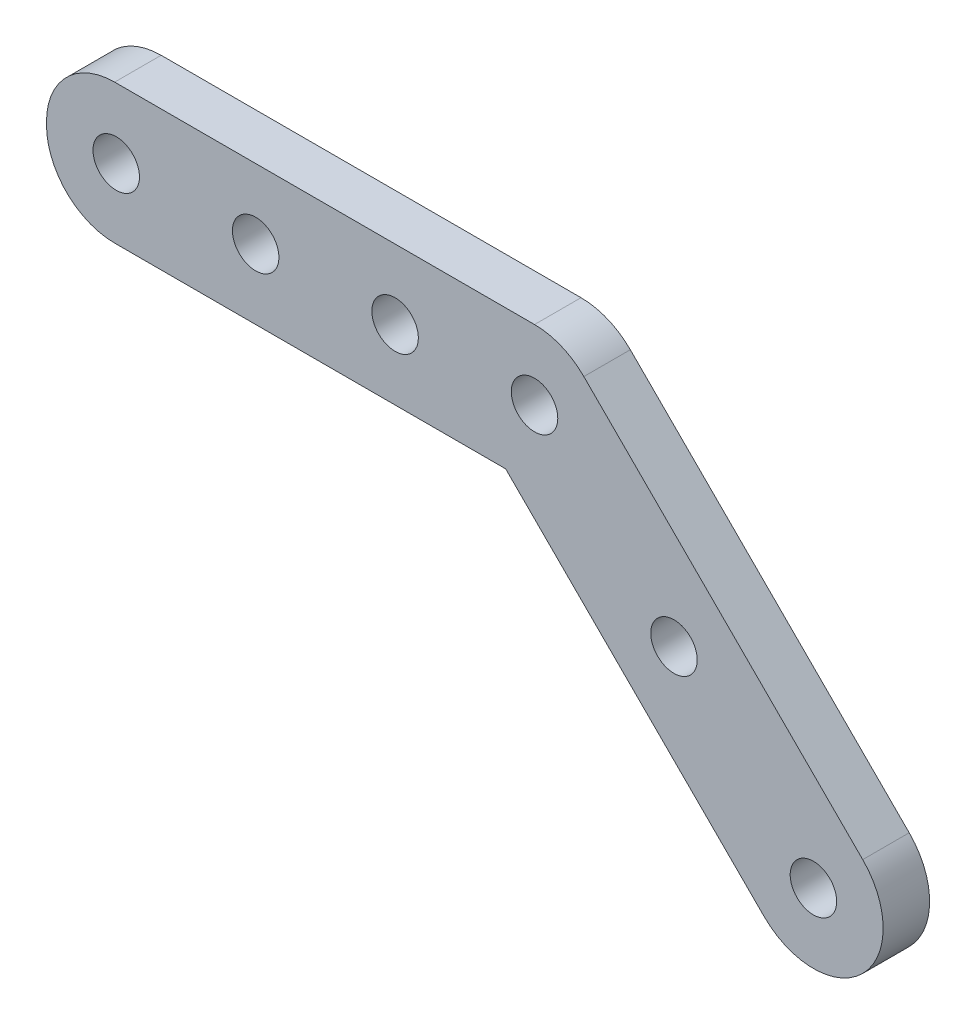
from build123d import *

# Parameters (mm, degrees)
MODEL_R                 = 1.5
SALIENTE_EXTRUIR1_DEPTH = 3


with BuildPart() as part:
    # Model → Saliente-Extruir1 (new body)
    with BuildSketch(Plane.XY):
        with BuildLine():
            Line((145.837507261, 264.056255289), (162.519487777, 247.374274774))
            ThreePointArc((162.519487777, 247.374274774), (168.883448807, 247.374274774), (168.883448807, 253.738235805))
            Line((168.883448807, 253.738235805), (150.883448807, 271.738235805))
            ThreePointArc((150.883448807, 271.738235805), (149.423543738, 272.713713186), (147.701468292, 273.056255289))
            Line((147.701468292, 273.056255289), (120.601468292, 273.056255289))
            ThreePointArc((120.601468292, 273.056255289), (117.490198455, 271.767525127), (116.201468292, 268.656255289))
            Line((116.201468292, 268.656255289), (116.201468292, 268.456255289))
            ThreePointArc((116.201468292, 268.456255289), (117.490198455, 265.344985452), (120.601468292, 264.056255289))
            Line((120.601468292, 264.056255289), (145.837507261, 264.056255289))
        make_face()
        with Locations((129.701468292, 268.556255289)):
            Circle(MODEL_R, mode=Mode.SUBTRACT)
        with Locations((138.701468292, 268.556255289)):
            Circle(MODEL_R, mode=Mode.SUBTRACT)
        with Locations((120.701468292, 268.556255289)):
            Circle(MODEL_R, mode=Mode.SUBTRACT)
        with Locations((147.701468292, 268.556255289)):
            Circle(MODEL_R, mode=Mode.SUBTRACT)
        with Locations((165.701468292, 250.556255289)):
            Circle(MODEL_R, mode=Mode.SUBTRACT)
        with Locations((156.701468292, 259.556255289)):
            Circle(MODEL_R, mode=Mode.SUBTRACT)
    extrude(amount=SALIENTE_EXTRUIR1_DEPTH)


solid = part.part
